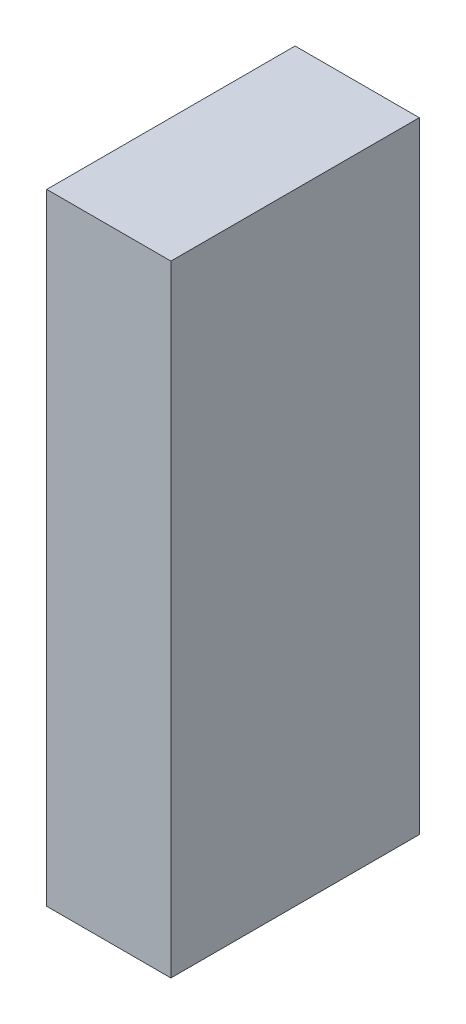
from build123d import *

# Parameters (mm, degrees)
SKETCH1_W           = 50
SKETCH1_H           = 100
BOSS_EXTRUDE1_DEPTH = 250
SKETCH2_R           = 1.5
CUT_EXTRUDE1_DEPTH  = 5
SKETCH3_R           = 1.5
CUT_EXTRUDE2_DEPTH  = 5


with BuildPart() as part:
    # Sketch1 → Boss-Extrude1 (new body)
    with BuildSketch(Plane(origin=(0, 0, 0), x_dir=(1, 0, 0), z_dir=(0, 1, 0))):
        Rectangle(SKETCH1_W, SKETCH1_H)
    extrude(amount=BOSS_EXTRUDE1_DEPTH)

    # Sketch2 → Cut-Extrude1 (cut)
    with BuildSketch(Plane.ZY.offset(25)):
        with Locations((38, 225)):
            Circle(SKETCH2_R)
        with Locations((38, 100)):
            Circle(SKETCH2_R)
        with Locations((-38, 225)):
            Circle(SKETCH2_R)
        with Locations((-38, 100)):
            Circle(SKETCH2_R)
    extrude(amount=-CUT_EXTRUDE1_DEPTH, mode=Mode.SUBTRACT)

    # Sketch3 → Cut-Extrude2 (cut)
    with BuildSketch(Plane(origin=(0, 0, -50), x_dir=(-1, 0, 0), z_dir=(0, 0, -1))):
        with Locations((-0.25, 47)):
            Circle(SKETCH3_R)
        with Locations((-11.25, 47)):
            Circle(SKETCH3_R)
    extrude(amount=-CUT_EXTRUDE2_DEPTH, mode=Mode.SUBTRACT)


solid = part.part
